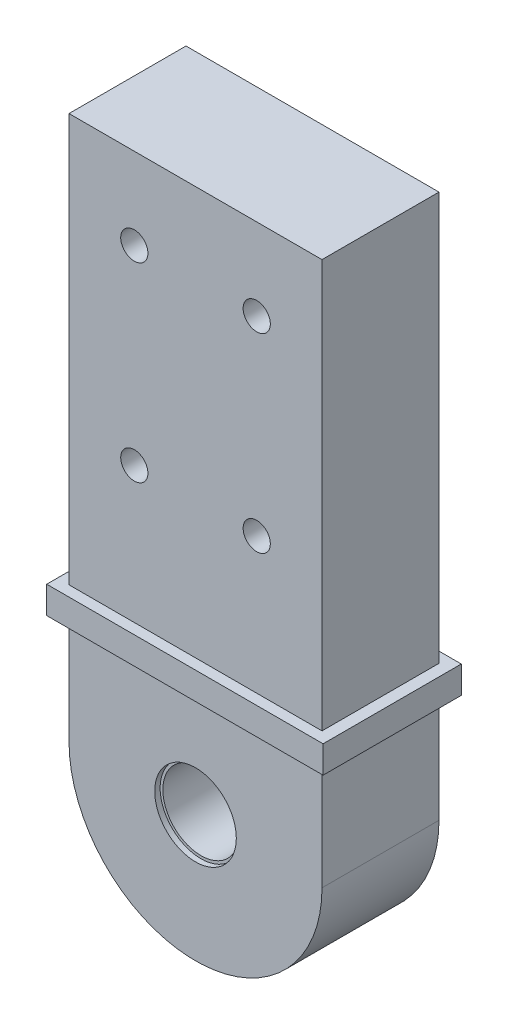
from build123d import *

# Parameters (mm, degrees)
SKETCH1_R           = 7
SKETCH1_R_2         = 2.5
BOSS_EXTRUDE1_DEPTH = 21.5
SKETCH2_R           = 7.5
CUT_EXTRUDE1_DEPTH  = 1
CUT_EXTRUDE2_START  = -1
SKETCH3_R           = 7.5
CUT_EXTRUDE2_DEPTH  = 1
SKETCH5_W           = 50.8
SKETCH5_H           = 25.4
SKETCH5_W_2         = 46.5
SKETCH5_H_2         = 21.5
BOSS_EXTRUDE2_DEPTH = 5


with BuildPart() as part:
    # Sketch1 → Boss-Extrude1 (new body)
    with BuildSketch(Plane.XY):
        with BuildLine():
            Line((-23.25, 0), (-23.25, 100))
            Line((-23.25, 100), (23.25, 100))
            Line((23.25, 100), (23.25, 0))
            ThreePointArc((23.25, 0), (0, -23.25), (-23.25, 0))
        make_face()
        Circle(SKETCH1_R, mode=Mode.SUBTRACT)
        with Locations((-11.25, 85)):
            Circle(SKETCH1_R_2, mode=Mode.SUBTRACT)
        with Locations((11.25, 85)):
            Circle(SKETCH1_R_2, mode=Mode.SUBTRACT)
        with Locations((11.25, 50)):
            Circle(SKETCH1_R_2, mode=Mode.SUBTRACT)
        with Locations((-11.25, 50)):
            Circle(SKETCH1_R_2, mode=Mode.SUBTRACT)
    extrude(amount=BOSS_EXTRUDE1_DEPTH)

    # Sketch2 → Cut-Extrude1 (cut)
    with BuildSketch(Plane.XY.offset(21.5)):
        Circle(SKETCH2_R)
    extrude(amount=-CUT_EXTRUDE1_DEPTH, mode=Mode.SUBTRACT)

    # Sketch3 → Cut-Extrude2 (cut)
    with BuildSketch(Plane(origin=(0, 0, 0), x_dir=(-1, 0, 0), z_dir=(0, 0, -1)).offset(CUT_EXTRUDE2_START)):
        with Locations(Location((0, 0, 0), (0, 0, 180))):
            Circle(SKETCH3_R)
    extrude(amount=CUT_EXTRUDE2_DEPTH, mode=Mode.SUBTRACT)

    # Sketch5 → Boss-Extrude2 (add)
    with BuildSketch(Plane(origin=(0, 24.981, 0), x_dir=(1, 0, 0), z_dir=(0, 1, 0))):
        with Locations((0, -10.75)):
            Rectangle(SKETCH5_W, SKETCH5_H)
        with Locations((0, -10.75)):
            Rectangle(SKETCH5_W_2, SKETCH5_H_2, mode=Mode.SUBTRACT)
    extrude(amount=-BOSS_EXTRUDE2_DEPTH)


solid = part.part
